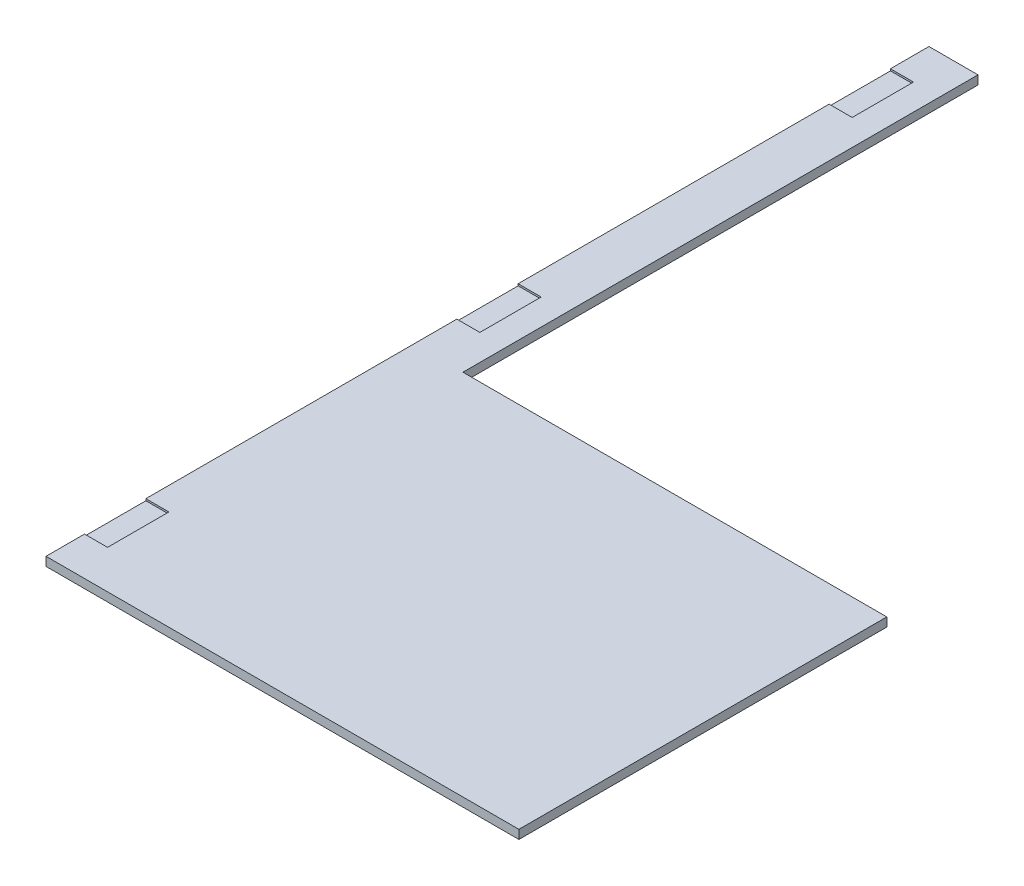
from build123d import *

# Parameters (mm, degrees)
BOSS_EXTRUDE1_DEPTH = 18.25625
SKETCH2_W           = 47.752
SKETCH2_H           = 127
CUT_EXTRUDE1_DEPTH  = 3.81


with BuildPart() as part:
    # Sketch1 → Boss-Extrude1 (new body)
    with BuildSketch(Plane(origin=(0, 0, 0), x_dir=(1, 0, 0), z_dir=(0, 1, 0))):
        Polygon((-489.74375, 381), (-489.74375, 1447.8), (-388.14375, 1447.8), (-388.14375, 381), (489.74375, 381), (489.74375, -381), (-489.74375, -381), align=None)
    extrude(amount=BOSS_EXTRUDE1_DEPTH)

    # Sketch2 → Cut-Extrude1 (cut)
    with BuildSketch(Plane(origin=(0, 18.25625, 0), x_dir=(1, 0, 0), z_dir=(0, 1, 0))):
        with Locations((-465.86775, 1304.527191457)):
            Rectangle(SKETCH2_W, SKETCH2_H)
        with Locations((-465.86775, 533.4)):
            Rectangle(SKETCH2_W, SKETCH2_H)
        with Locations((-465.86775, -237.727191457)):
            Rectangle(SKETCH2_W, SKETCH2_H)
    extrude(amount=-CUT_EXTRUDE1_DEPTH, mode=Mode.SUBTRACT)


solid = part.part
